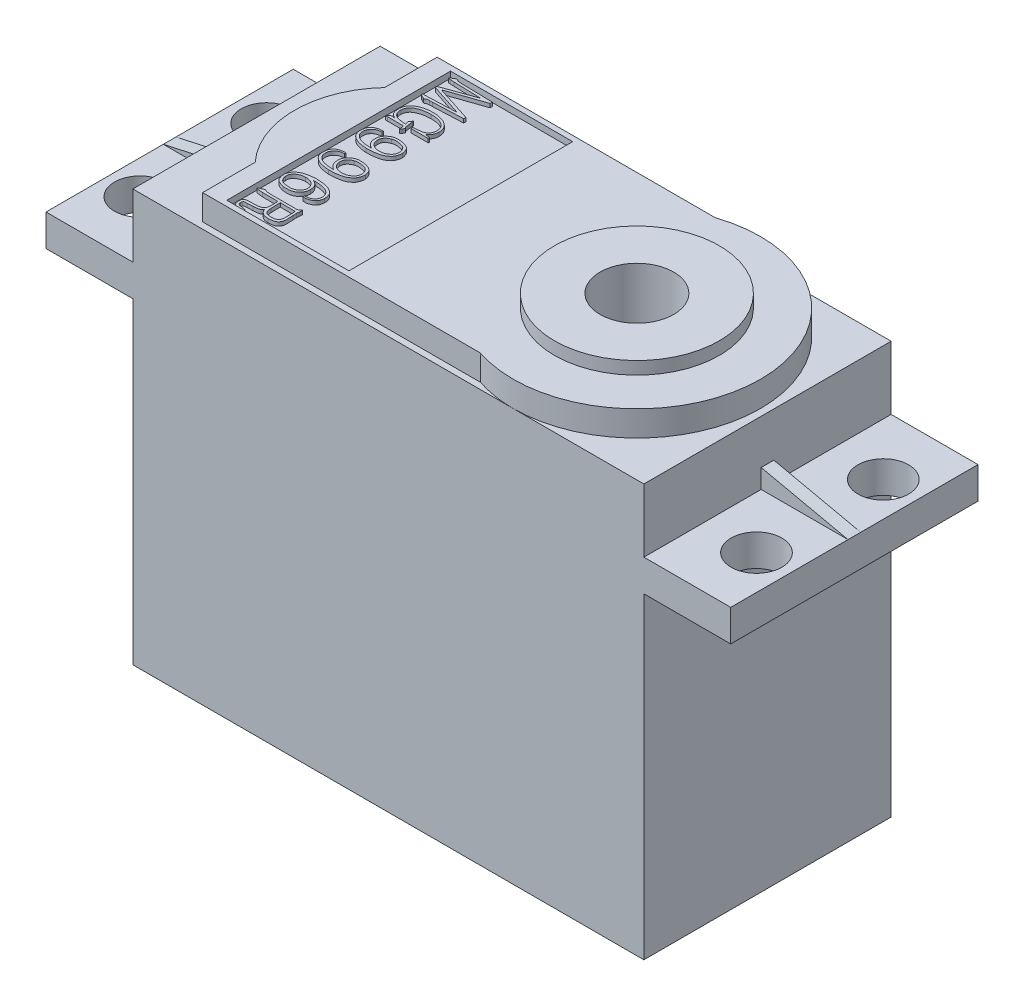
from build123d import *

# Parameters (mm, degrees)
SKETCH_1_W          = 40.3
SKETCH_1_H          = 19.5
EXTRUDE_1_DEPTH     = 27
SKETCH_2_W          = 54
SKETCH_2_H          = 19.5
EXTRUDE_2_DEPTH     = 2.5
SKETCH_3_W          = 40.3
SKETCH_3_H          = 19.5
EXTRUDE_3_DEPTH     = 5
EXTRUDE_4_DEPTH     = 2
RIB_1_REACH         = 48.436
SKETCH_5_WALL_W     = 101.884534654
SKETCH_5_WALL_H     = 1
RIB_2_REACH         = 48.436
SKETCH_6_WALL_W     = 101.884534654
SKETCH_6_WALL_H     = 1
SKETCH_7_R          = 6.5
EXTRUDE_5_DEPTH     = 1
SKETCH_8_R          = 2.9
CUT_EXTRUDE_1_DEPTH = 5
SKETCH_9_R          = 2
CUT_EXTRUDE_2_DEPTH = 5
CHAMFER_1_SIZE      = 2
SKETCH_10_W         = 9.636787174
SKETCH_10_H         = 17.646584306
CUT_EXTRUDE_3_DEPTH = 0.5
EXTRUDE_6_DEPTH     = 0.3


with BuildPart() as part:
    # 草图1 → 凸台-拉伸1 (new body)
    with BuildSketch(Plane(origin=(0, 0, 0), x_dir=(1, 0, 0), z_dir=(0, 1, 0))):
        Rectangle(SKETCH_1_W, SKETCH_1_H)
    extrude(amount=EXTRUDE_1_DEPTH)

    # 草图2 → 凸台-拉伸2 (add)
    with BuildSketch(Plane(origin=(0, 27, 0), x_dir=(1, 0, 0), z_dir=(0, 1, 0))):
        Rectangle(SKETCH_2_W, SKETCH_2_H)
    extrude(amount=EXTRUDE_2_DEPTH)

    # 草图3 → 凸台-拉伸3 (add)
    with BuildSketch(Plane(origin=(0, 29.5, 0), x_dir=(1, 0, 0), z_dir=(0, 1, 0))):
        Rectangle(SKETCH_3_W, SKETCH_3_H)
    extrude(amount=EXTRUDE_3_DEPTH)

    # 草图4 → 凸台-拉伸4 (add)
    with BuildSketch(Plane(origin=(0, 34.5, 0), x_dir=(1, 0, 0), z_dir=(0, 1, 0))):
        with BuildLine():
            Line((-15.15, -9.25), (-15.15, -5.099019514))
            ThreePointArc((-15.15, -5.099019514), (-17.15, 0), (-15.15, 5.099019514))
            Line((-15.15, 5.099019514), (-15.15, 9.25))
            Line((-15.15, 9.25), (6.767792999, 9.25))
            ThreePointArc((6.767792999, 9.25), (19.6, 0), (6.767792999, -9.25))
            Line((6.767792999, -9.25), (-15.15, -9.25))
        make_face()
    extrude(amount=EXTRUDE_4_DEPTH)

    # 草图5 wall → 筋1 (add, up to next)
    with BuildSketch(Plane(origin=(23.575, 30.25, 0), x_dir=(0.976853477736, -0.213909520672, 0), z_dir=(0.213909520672, 0.976853477736, 0)), mode=Mode.PRIVATE) as rib_1_sk1:
        Rectangle(SKETCH_5_WALL_W, SKETCH_5_WALL_H)
    rib_1_tool1 = extrude(rib_1_sk1.sketch, amount=-RIB_1_REACH, mode=Mode.PRIVATE) - part.part
    add(rib_1_tool1.solids().sort_by_distance((23.575, 30.25, 0))[0])

    # 草图6 wall → 筋2 (add, up to next)
    with BuildSketch(Plane(origin=(-23.575, 30.25, 0), x_dir=(-0.976853477736, -0.213909520672, 0), z_dir=(0.213909520672, -0.976853477736, 0)), mode=Mode.PRIVATE) as rib_2_sk1:
        Rectangle(SKETCH_6_WALL_W, SKETCH_6_WALL_H)
    rib_2_tool1 = extrude(rib_2_sk1.sketch, amount=RIB_2_REACH, mode=Mode.PRIVATE) - part.part
    add(rib_2_tool1.solids().sort_by_distance((-23.575, 30.25, 0))[0])

    # 草图7 → 凸台-拉伸5 (add)
    with BuildSketch(Plane(origin=(0, 36.5, 0), x_dir=(1, 0, 0), z_dir=(0, 1, 0))):
        with Locations(Location((9.85, 0, 0), (0, 0, 270))):
            Circle(SKETCH_7_R)
    extrude(amount=EXTRUDE_5_DEPTH)

    # 草图8 → 切除-拉伸1 (cut)
    with BuildSketch(Plane(origin=(0, 37.5, 0), x_dir=(1, 0, 0), z_dir=(0, 1, 0))):
        with Locations(Location((9.85, 0, 0), (0, 0, 270))):
            Circle(SKETCH_8_R)
    extrude(amount=-CUT_EXTRUDE_1_DEPTH, mode=Mode.SUBTRACT)

    # 草图9 → 切除-拉伸2 (cut)
    with BuildSketch(Plane(origin=(0, 29.5, 0), x_dir=(1, 0, 0), z_dir=(0, 1, 0))):
        with Locations(Location((-24.35, 5, 0), (0, 0, 270))):
            Circle(SKETCH_9_R)
        with Locations(Location((24.28, 5, 0), (0, 0, 270))):
            Circle(SKETCH_9_R)
        with Locations(Location((24.28, -5, 0), (0, 0, 270))):
            Circle(SKETCH_9_R)
        with Locations(Location((-24.35, -5, 0), (0, 0, 270))):
            Circle(SKETCH_9_R)
    extrude(amount=-CUT_EXTRUDE_2_DEPTH, mode=Mode.SUBTRACT)

    # 倒角1
    chamfer_1_edges = [part.edges().sort_by_distance(p)[0] for p in [
        (0, 0, 9.75),
        (-20.15, 0, 0),
        (0, 0, -9.75),
        (20.15, 0, 0),
    ]]
    chamfer(chamfer_1_edges, length=CHAMFER_1_SIZE)

    # 草图10 → 切除-拉伸3 (cut)
    with BuildSketch(Plane(origin=(0, 36.5, 0), x_dir=(1, 0, 0), z_dir=(0, 1, 0))):
        with Locations((-8.854580423, 0)):
            Rectangle(SKETCH_10_W, SKETCH_10_H)
    extrude(amount=-CUT_EXTRUDE_3_DEPTH, mode=Mode.SUBTRACT)

    # 草图11 → 凸台-拉伸6 (add)
    # profile 1 of 6: a face of its own
    with BuildSketch(Plane(origin=(0, 36, 0), x_dir=(1, 0, 0), z_dir=(0, 1, 0))):
        with BuildLine():
            Line((-10.108835932, 6.465099099), (-10.108835932, 6.292075447))
            Line((-10.108835932, 6.292075447), (-12.470012152, 6.186918831))
            Line((-12.470012152, 6.186918831), (-12.691512258, 6.179460915))
            add(Edge.make_bspline(
                [(-12.691512258, 6.179460915), (-12.704682236, 6.179133247), (-12.729283425, 6.178521171), (-12.76346004, 6.178820017), (-12.791956525, 6.175085343), (-12.82366459, 6.171706911), (-12.861096032, 6.161497876), (-12.905501006, 6.14652074), (-12.948600061, 6.12856097), (-12.983579582, 6.105935535), (-13.009940886, 6.088203492), (-13.030941587, 6.076001018), (-13.052071154, 6.081143252), (-13.07675673, 6.092617885), (-13.114417302, 6.110357592), (-13.1428217, 6.125832205), (-13.159123594, 6.134713418)],
                knots=[0, 0, 0, 0, 1.102701008, 2.059818031, 2.854660456, 3.504867835, 4.725821617, 6.087517188, 7.428720521, 8.623884165, 9.541296161, 10.147772796, 10.527373255, 11.292252643, 12.445965619, 14, 14, 14, 14], degree=3))
            Line((-13.159123594, 6.134713418), (-13.330655663, 6.217496286))
            add(Edge.make_bspline(
                [(-13.330655663, 6.217496286), (-13.346301752, 6.226705906), (-13.373957393, 6.242984603), (-13.410242295, 6.264089838), (-13.434260872, 6.280820261), (-13.451111532, 6.295883627), (-13.457639739, 6.312784037), (-13.460491623, 6.329808581), (-13.454018711, 6.344742876), (-13.445383369, 6.349890937), (-13.441032821, 6.352484567)],
                knots=[0, 0, 0, 0, 2.092832486, 3.699239191, 4.828075347, 5.47623227, 6.258606608, 6.862868476, 7.427104806, 8, 8, 8, 8], degree=3))
            add(Edge.make_bspline(
                [(-13.441032821, 6.352484567), (-13.435046209, 6.357006622), (-13.420471597, 6.368015719), (-13.386613915, 6.370427585), (-13.342683956, 6.368829873), (-13.309272674, 6.363152374), (-13.290382917, 6.359942483)],
                knots=[0, 0, 0, 0, 0.570562757, 1.389054623, 2.523848169, 4, 4, 4, 4], degree=3))
            Line((-13.290382917, 6.359942483), (-12.973421485, 6.374858315))
            Line((-12.973421485, 6.374858315), (-10.793472625, 6.465099099))
            Line((-10.793472625, 6.465099099), (-13.350792036, 7.306352029))
            Line((-13.350792036, 7.306352029), (-13.345571495, 7.448798226))
            Line((-13.345571495, 7.448798226), (-10.823304289, 8.357918191))
            Line((-10.823304289, 8.357918191), (-12.998032608, 8.41758152))
            Line((-12.998032608, 8.41758152), (-13.31051929, 8.432497352))
            add(Edge.make_bspline(
                [(-13.31051929, 8.432497352), (-13.333162395, 8.433096925), (-13.373834867, 8.434173904), (-13.421285793, 8.442738496), (-13.449423132, 8.454520513), (-13.463828559, 8.462840882), (-13.47192037, 8.474097008), (-13.471707613, 8.481885371), (-13.471610276, 8.485448556)],
                knots=[0, 0, 0, 0, 2.238805083, 4.021433183, 4.714937999, 5.246364549, 5.655210975, 6, 6, 6, 6], degree=3))
            add(Edge.make_bspline(
                [(-13.471610276, 8.485448556), (-13.471003507, 8.490422698), (-13.469760989, 8.500608544), (-13.464368444, 8.518920478), (-13.441676521, 8.536983875), (-13.414414844, 8.549644392), (-13.389590289, 8.562388056), (-13.373328787, 8.568741699), (-13.363189557, 8.57381118), (-13.357766391, 8.57523038), (-13.356012578, 8.57568934)],
                knots=[0, 0, 0, 0, 0.773964204, 1.584892381, 2.85704835, 5.031717749, 6.264108979, 7.138477416, 7.721389708, 8, 8, 8, 8], degree=3))
            Line((-13.356012578, 8.57568934), (-13.12929193, 8.71067762))
            add(Edge.make_bspline(
                [(-13.12929193, 8.71067762), (-13.118000132, 8.714835489), (-13.096054756, 8.722916221), (-13.059642734, 8.719188617), (-13.021934201, 8.706021239), (-12.983971195, 8.684010086), (-12.947744176, 8.664578412), (-12.922530612, 8.648111569), (-12.902132595, 8.640318917), (-12.88212722, 8.635425917), (-12.855703991, 8.631003339), (-12.824755874, 8.627925206), (-12.793918658, 8.624541087), (-12.76736622, 8.621186615), (-12.747347371, 8.619676373), (-12.733594573, 8.616659085), (-12.721571031, 8.615919225), (-12.707482285, 8.613910168), (-12.687009353, 8.613953079), (-12.660454325, 8.611939052), (-12.62762641, 8.610625844), (-12.588826672, 8.609354422), (-12.543871504, 8.606605495), (-12.511781227, 8.605898838), (-12.494623275, 8.605521004)],
                knots=[0, 0, 0, 0, 1.194424872, 2.321340004, 3.585598028, 5.195084956, 6.716837907, 7.724099835, 8.206680761, 8.903637039, 9.790942755, 10.897450691, 12.028789452, 12.90903052, 13.587833776, 14.043805438, 14.319796903, 14.797174648, 15.472288729, 16.373211185, 17.473778476, 18.774068007, 20.27516646, 22, 22, 22, 22], degree=3))
            Line((-12.494623275, 8.605521004), (-10.108835932, 8.5525698))
            Line((-10.108835932, 8.5525698), (-10.108835932, 8.372834024))
            Line((-10.108835932, 8.372834024), (-12.957759861, 7.389134897))
            Line((-12.957759861, 7.389134897), (-10.108835932, 6.465099099))
        make_face()
    # profile 2 of 6: a face of its own
    with BuildSketch(Plane(origin=(0, 36, 0), x_dir=(1, 0, 0), z_dir=(0, 1, 0))):
        with BuildLine():
            add(Edge.make_bspline(
                [(-12.016570856, 3.633097388), (-12.021647518, 3.652280636), (-12.03076964, 3.68675051), (-12.044719979, 3.731948407), (-12.053858919, 3.765503045), (-12.059780228, 3.783512837), (-12.062064144, 3.790459417)],
                knots=[0, 0, 0, 0, 1.45335447, 2.611494566, 3.464437835, 4, 4, 4, 4], degree=3))
            Line((-12.062064144, 3.790459417), (-12.091895808, 3.880700201))
            Line((-12.091895808, 3.880700201), (-11.961382277, 4.091013434))
            add(Edge.make_bspline(
                [(-11.961382277, 4.091013434), (-11.95764498, 4.098911304), (-11.951203836, 4.112523098), (-11.9402981, 4.127653424), (-11.932880434, 4.139131161), (-11.921639555, 4.141195757), (-11.912024596, 4.136085521), (-11.902286107, 4.128530848), (-11.895018331, 4.115280171), (-11.892214574, 4.104775229), (-11.890532075, 4.09847135)],
                knots=[0, 0, 0, 0, 1.721478549, 2.96692782, 3.770230587, 4.273468087, 5.07068514, 5.841502061, 6.704713207, 8, 8, 8, 8], degree=3))
            Line((-11.890532075, 4.09847135), (-11.890532075, 3.918735573))
            Line((-11.890532075, 3.918735573), (-11.865920952, 3.760627753))
            Line((-11.865920952, 3.760627753), (-11.840564037, 3.565230352))
            add(Edge.make_bspline(
                [(-11.840564037, 3.565230352), (-11.840162028, 3.559252954), (-11.839235864, 3.545481981), (-11.835041955, 3.522132366), (-11.829179632, 3.492957832), (-11.820824383, 3.460321199), (-11.810937942, 3.428741104), (-11.801494117, 3.402090312), (-11.791997148, 3.382421014), (-11.783550362, 3.373442244), (-11.780154917, 3.369832952)],
                knots=[0, 0, 0, 0, 0.693923818, 1.598689782, 2.745819235, 4.143502487, 5.501415895, 6.57721006, 7.428066009, 8, 8, 8, 8], degree=3))
            Line((-11.780154917, 3.369832952), (-11.729441088, 3.325085456))
            Line((-11.729441088, 3.325085456), (-11.865920952, 3.099856391))
            add(Edge.make_bspline(
                [(-11.865920952, 3.099856391), (-11.87243382, 3.091409429), (-11.884179754, 3.076175366), (-11.909245223, 3.068627838), (-11.930942215, 3.070906442), (-11.938114446, 3.080675364), (-11.941245904, 3.084940559)],
                knots=[0, 0, 0, 0, 1.365288393, 2.462292284, 3.328623616, 4, 4, 4, 4], degree=3))
            Line((-11.941245904, 3.084940559), (-11.946466445, 3.137145971))
            Line((-11.946466445, 3.137145971), (-11.976298109, 3.422784156))
            Line((-11.976298109, 3.422784156), (-13.229973797, 3.422784156))
            add(Edge.make_bspline(
                [(-13.229973797, 3.422784156), (-13.244392973, 3.422738407), (-13.271493518, 3.422652422), (-13.309039452, 3.423205097), (-13.340625763, 3.42499793), (-13.365941229, 3.426048294), (-13.385578137, 3.428418335), (-13.398365183, 3.430384001), (-13.407429015, 3.432443232), (-13.411696813, 3.445012453), (-13.385309586, 3.460625178), (-13.36488436, 3.486651192), (-13.336295309, 3.511054655), (-13.317530409, 3.523347721), (-13.31051929, 3.527940772)],
                knots=[0, 0, 0, 0, 1.639098295, 3.080651418, 4.268929633, 5.231441294, 5.971084531, 6.486786894, 6.765118723, 6.917305179, 7.861808722, 9.440596986, 11.043731724, 12, 12, 12, 12], degree=3))
            Line((-13.31051929, 3.527940772), (-13.244889629, 3.565230352))
            Line((-13.244889629, 3.565230352), (-13.159123594, 3.633097388))
            add(Edge.make_bspline(
                [(-13.159123594, 3.633097388), (-13.146154335, 3.644078661), (-13.123962245, 3.662869046), (-13.095589921, 3.668179848), (-13.083798642, 3.670386969)],
                knots=[0, 0, 0, 0, 1.168818219, 2, 2, 2, 2], degree=3))
            Line((-13.083798642, 3.670386969), (-13.033830605, 3.64801322))
            Line((-13.033830605, 3.64801322), (-12.852603245, 3.603265724))
            add(Edge.make_bspline(
                [(-12.852603245, 3.603265724), (-12.867399777, 3.612186044), (-12.903250392, 3.633799144), (-12.968893526, 3.664498462), (-13.047123989, 3.711006729), (-13.117809344, 3.760299608), (-13.174934311, 3.811766987), (-13.213339127, 3.862889077), (-13.248589014, 3.922388097), (-13.279385523, 3.990143332), (-13.303949319, 4.064058483), (-13.323898904, 4.140922715), (-13.335616519, 4.220456159), (-13.338762673, 4.274196694), (-13.340350954, 4.301326666)],
                knots=[0, 0, 0, 0, 0.682902113, 1.654608042, 2.861894888, 4.27790553, 5.056999099, 5.890804738, 6.7945336, 7.788805481, 8.827203978, 9.871588867, 10.925508771, 12, 12, 12, 12], degree=3))
            add(Edge.make_bspline(
                [(-13.340350954, 4.301326666), (-13.341940522, 4.350836096), (-13.345091513, 4.448978324), (-13.326442491, 4.592912429), (-13.292190675, 4.726681274), (-13.25368063, 4.830601442), (-13.213612534, 4.906343899), (-13.177069526, 4.960352736), (-13.135370597, 5.013586381), (-13.086579538, 5.065131773), (-13.030565256, 5.115198821), (-12.968467346, 5.165453956), (-12.897407972, 5.212437881), (-12.821414587, 5.26072982), (-12.73809616, 5.304610792), (-12.649992499, 5.346457258), (-12.555596708, 5.381607507), (-12.457731362, 5.413206976), (-12.358925393, 5.440526842), (-12.262587694, 5.46268715), (-12.170095629, 5.480355716), (-12.0495276, 5.496170554), (-11.893992789, 5.507582247), (-11.698364174, 5.512172169), (-11.490086988, 5.505114558), (-11.348942954, 5.483844991), (-11.276745584, 5.472965277)],
                knots=[0, 0, 0, 0, 1.296855289, 2.57074797, 3.787781431, 4.912090985, 5.466017155, 6.029935049, 6.619226251, 7.236981103, 7.887517514, 8.587730122, 9.328811339, 10.1190631, 10.947078726, 11.7954872, 12.674165492, 13.585070334, 14.490996303, 15.360442995, 16.175900064, 16.95837495, 18.546785394, 20.261144089, 22.087517035, 24, 24, 24, 24], degree=3))
            add(Edge.make_bspline(
                [(-11.276745584, 5.472965277), (-11.216348356, 5.460773639), (-11.091172659, 5.435505976), (-10.936361232, 5.387401561), (-10.81054485, 5.339150776), (-10.716945988, 5.294161799), (-10.626009385, 5.2411581), (-10.539301178, 5.181241338), (-10.458164336, 5.117914641), (-10.38874973, 5.049025594), (-10.330268829, 4.977785742), (-10.28462195, 4.904086956), (-10.249144363, 4.832119898), (-10.219122017, 4.765825903), (-10.198344634, 4.704467913), (-10.178965571, 4.62962431), (-10.166206376, 4.535641468), (-10.161318651, 4.460208543), (-10.158803969, 4.421399114)],
                knots=[0, 0, 0, 0, 1.756852838, 3.641148545, 4.615675158, 5.598961219, 6.599988407, 7.614985252, 8.604008524, 9.53171328, 10.398925515, 11.227312903, 11.997988587, 12.687082964, 13.301564504, 13.84336769, 14.890435854, 16, 16, 16, 16], degree=3))
            add(Edge.make_bspline(
                [(-10.158803969, 4.421399114), (-10.159141256, 4.39701416), (-10.159800316, 4.349365888), (-10.167630771, 4.279849194), (-10.179363786, 4.213999276), (-10.201223391, 4.131357165), (-10.2408323, 4.032759587), (-10.296319275, 3.943804905), (-10.343832513, 3.880375629), (-10.374724041, 3.840206157), (-10.400800081, 3.808079983), (-10.418222387, 3.790601084), (-10.425797364, 3.783001501)],
                knots=[0, 0, 0, 0, 1.02865205, 2.009989184, 2.948380583, 3.849248544, 5.614353784, 7.40828352, 8.256022902, 8.959034023, 9.547402437, 10, 10, 10, 10], degree=3))
            Line((-10.425797364, 3.783001501), (-10.506342857, 3.723338172))
            Line((-10.506342857, 3.723338172), (-10.149108678, 3.633097388))
            Line((-10.149108678, 3.633097388), (-10.149108678, 3.542856604))
            Line((-10.149108678, 3.542856604), (-11.513161523, 3.542856604))
            Line((-11.513161523, 3.542856604), (-11.518382064, 3.700964424))
            add(Edge.make_bspline(
                [(-11.518382064, 3.700964424), (-11.494516912, 3.700993837), (-11.443306274, 3.701056952), (-11.362996534, 3.700518785), (-11.277679241, 3.702741595), (-11.204310309, 3.706944425), (-11.142412917, 3.71285101), (-11.089765308, 3.719851413), (-11.030540559, 3.727917603), (-10.945737283, 3.741418456), (-10.843168344, 3.761391359), (-10.728025613, 3.794020556), (-10.624300382, 3.846026221), (-10.545049291, 3.90394052), (-10.486576367, 3.9598194), (-10.448308991, 4.006569324), (-10.415692478, 4.056163292), (-10.389682737, 4.109701182), (-10.368430427, 4.166860401), (-10.353527533, 4.228313927), (-10.340794228, 4.293429615), (-10.337334012, 4.33855561), (-10.335556579, 4.361735786)],
                knots=[0, 0, 0, 0, 0.935739115, 2.007940184, 3.148747064, 4.28148865, 4.888643423, 5.586238389, 6.363702558, 7.232250513, 8.952694186, 10.46050143, 11.907734915, 13.477168468, 14.290584882, 15.073104099, 15.840915301, 16.612491364, 17.401961071, 18.22703269, 19.08926784, 20, 20, 20, 20], degree=3))
            add(Edge.make_bspline(
                [(-10.335556579, 4.361735786), (-10.335580197, 4.397066303), (-10.335625925, 4.465472279), (-10.347582513, 4.565124053), (-10.37015442, 4.65780567), (-10.401475804, 4.745057683), (-10.444097366, 4.826727585), (-10.500686167, 4.901700191), (-10.567916464, 4.972556241), (-10.647656039, 5.035118281), (-10.733041407, 5.091670803), (-10.8214353, 5.141257933), (-10.911764576, 5.182876201), (-11.00429001, 5.213827957), (-11.09535869, 5.240115387), (-11.184887601, 5.25998781), (-11.271589532, 5.276293122), (-11.384409812, 5.288266877), (-11.523188684, 5.297704281), (-11.633961755, 5.29919746), (-11.689168342, 5.299941624)],
                knots=[0, 0, 0, 0, 1.020336309, 1.975547117, 2.892045996, 3.771563378, 4.648848181, 5.542539332, 6.477435802, 7.463615751, 8.463825308, 9.435109215, 10.389941754, 11.332781131, 12.251473469, 13.128081502, 13.982025083, 14.799156052, 16.404777764, 18, 18, 18, 18], degree=3))
            add(Edge.make_bspline(
                [(-11.689168342, 5.299941624), (-11.724974246, 5.299471703), (-11.798136937, 5.298511507), (-11.909638669, 5.291772929), (-12.025001156, 5.279418405), (-12.14221632, 5.263456395), (-12.258135948, 5.243300153), (-12.368366602, 5.217110383), (-12.471587762, 5.186846331), (-12.566628434, 5.151572511), (-12.653503114, 5.11472244), (-12.730847334, 5.076515869), (-12.799523511, 5.039492682), (-12.859015828, 5.00117928), (-12.911027122, 4.961688993), (-12.958378925, 4.921762301), (-12.998043298, 4.877093274), (-13.045568035, 4.817749644), (-13.091724475, 4.738586852), (-13.134206575, 4.639833837), (-13.161405891, 4.533647798), (-13.166770118, 4.459846685), (-13.169564677, 4.421399114)],
                knots=[0, 0, 0, 0, 1.126994854, 2.302803905, 3.514286971, 4.778011192, 6.025865863, 7.215856767, 8.342308229, 9.409248108, 10.404825957, 11.311169663, 12.123616097, 12.859383373, 13.535435401, 14.178772448, 14.804598141, 15.411954719, 16.570030134, 17.674526722, 18.788516934, 20, 20, 20, 20], degree=3))
            add(Edge.make_bspline(
                [(-13.169564677, 4.421399114), (-13.16985608, 4.386316288), (-13.170441224, 4.315869475), (-13.157030293, 4.210912261), (-13.129869876, 4.109408321), (-13.087395742, 4.013953017), (-13.027141284, 3.928054887), (-12.952783995, 3.851832096), (-12.864987057, 3.789441367), (-12.767751494, 3.743352468), (-12.666254484, 3.71188741), (-12.564462631, 3.687752023), (-12.465114221, 3.673085447), (-12.368574285, 3.658374033), (-12.2702776, 3.647930969), (-12.203034871, 3.6430834), (-12.167966552, 3.640555304)],
                knots=[0, 0, 0, 0, 1.012518681, 2.033151841, 3.045161207, 4.038142276, 5.034026654, 6.059673631, 7.099696739, 8.127377512, 9.153727986, 10.16390169, 11.146023905, 12.052814435, 12.984506943, 14, 14, 14, 14], degree=3))
            Line((-12.167966552, 3.640555304), (-12.016570856, 3.633097388))
        make_face()
    # profile 3 of 6: a face of its own
    with BuildSketch(Plane(origin=(0, 36, 0), x_dir=(1, 0, 0), z_dir=(0, 1, 0))):
        with BuildLine():
            Line((-12.414077781, 2.268813555), (-12.414077781, 2.163656939))
            add(Edge.make_bspline(
                [(-12.414077781, 2.163656939), (-12.44542573, 2.160668995), (-12.507048225, 2.15479542), (-12.599993343, 2.141611829), (-12.696043038, 2.119254882), (-12.779345352, 2.091657499), (-12.849455582, 2.061763536), (-12.90176306, 2.029299544), (-12.954267596, 1.991653222), (-13.004197507, 1.946110866), (-13.051863982, 1.895943641), (-13.09468963, 1.840664874), (-13.131044182, 1.780210269), (-13.163353959, 1.716833701), (-13.188384197, 1.649106561), (-13.204328061, 1.577873112), (-13.213950786, 1.503412625), (-13.212825702, 1.427435802), (-13.207542935, 1.353594204), (-13.195936167, 1.28540785), (-13.181675372, 1.223692734), (-13.161066901, 1.167376939), (-13.132366663, 1.113616899), (-13.092264796, 1.060977341), (-13.043956236, 1.004929239), (-12.985498039, 0.947722114), (-12.916594011, 0.893202795), (-12.838495744, 0.842610722), (-12.750613574, 0.79907992), (-12.654824026, 0.760562789), (-12.551714342, 0.727991537), (-12.443203192, 0.701101815), (-12.32995949, 0.676969593), (-12.252330612, 0.666814914), (-12.212714048, 0.661632647)],
                knots=[0, 0, 0, 0, 1.161562506, 2.283351267, 3.460054047, 4.793976417, 5.516494263, 6.265077708, 7.059282141, 7.896977086, 8.753286989, 9.609842358, 10.470120195, 11.351831039, 12.23086742, 13.125078708, 14.039560616, 14.993248057, 15.92232611, 16.76806327, 17.542052076, 18.255787675, 18.973752159, 19.780770556, 20.690874171, 21.702495583, 22.792346145, 23.926806676, 25.12840101, 26.40383237, 27.73206904, 29.113223073, 30.526782984, 32, 32, 32, 32], degree=3))
            Line((-12.212714048, 0.661632647), (-11.915888989, 0.646716815))
            Line((-11.915888989, 0.646716815), (-11.719745797, 0.639258899))
            add(Edge.make_bspline(
                [(-11.719745797, 0.639258899), (-11.739747007, 0.649746172), (-11.777613157, 0.669600603), (-11.829647537, 0.700882217), (-11.875894713, 0.727884953), (-11.929015728, 0.761979623), (-11.988661304, 0.812380244), (-12.043950603, 0.870692419), (-12.085779294, 0.926515077), (-12.117480445, 0.975061982), (-12.14630396, 1.030681831), (-12.177392739, 1.090661998), (-12.202692749, 1.158498399), (-12.220518193, 1.234120407), (-12.230705647, 1.317153045), (-12.232116873, 1.375077846), (-12.232850421, 1.405186877)],
                knots=[0, 0, 0, 0, 0.96811683, 1.832831972, 2.602442467, 3.264690643, 4.536676004, 5.939331142, 6.700405402, 7.525311046, 8.421957077, 9.384896146, 10.420381823, 11.516576881, 12.70912866, 14, 14, 14, 14], degree=3))
            add(Edge.make_bspline(
                [(-12.232850421, 1.405186877), (-12.232715044, 1.449026481), (-12.232449848, 1.534905208), (-12.212699941, 1.640486274), (-12.186644903, 1.719994074), (-12.162684317, 1.778346849), (-12.132631424, 1.834798489), (-12.097562987, 1.890410817), (-12.055776597, 1.94448805), (-12.008560622, 1.997956038), (-11.953797877, 2.049877041), (-11.893834962, 2.10023768), (-11.830173425, 2.147798751), (-11.762997505, 2.188242095), (-11.694714092, 2.222513156), (-11.62396715, 2.250845196), (-11.549306263, 2.272538726), (-11.469224025, 2.288256456), (-11.382844054, 2.296882908), (-11.260569601, 2.300125219), (-11.106204748, 2.294580826), (-10.98404056, 2.277305763), (-10.923986155, 2.268813555)],
                knots=[0, 0, 0, 0, 1.441778134, 2.824342836, 3.513038675, 4.195722577, 4.898866133, 5.616586851, 6.358372924, 7.147065104, 7.963527037, 8.8409299, 9.725181631, 10.577472986, 11.419597639, 12.23905066, 13.08363918, 13.976378112, 14.923014095, 15.938750632, 18.003540029, 20, 20, 20, 20], degree=3))
            add(Edge.make_bspline(
                [(-10.923986155, 2.268813555), (-10.89431214, 2.263797098), (-10.832400256, 2.253330757), (-10.736909571, 2.227575847), (-10.636121448, 2.190028632), (-10.548601466, 2.153968912), (-10.479055449, 2.119308712), (-10.430340779, 2.089427208), (-10.386378535, 2.056477276), (-10.346184972, 2.021323467), (-10.310999484, 1.98261503), (-10.281502191, 1.94023537), (-10.254374513, 1.896272028), (-10.228587781, 1.833771264), (-10.202149444, 1.758760775), (-10.175310411, 1.675493616), (-10.157268708, 1.601213243), (-10.151693191, 1.554411864), (-10.149108678, 1.532717242)],
                knots=[0, 0, 0, 0, 1.232643308, 2.571787759, 4.044217922, 5.637139245, 6.447978167, 7.225371298, 7.975044785, 8.696580882, 9.410528117, 10.111496744, 10.810241716, 11.521787165, 12.874996824, 14.070206042, 15.105450454, 16, 16, 16, 16], degree=3))
            add(Edge.make_bspline(
                [(-10.149108678, 1.532717242), (-10.148474471, 1.497131692), (-10.147174111, 1.424168163), (-10.159725114, 1.331624044), (-10.176970542, 1.253800505), (-10.197746889, 1.190486256), (-10.223945955, 1.122101322), (-10.256518063, 1.050671028), (-10.296219652, 0.979619787), (-10.342981608, 0.912505364), (-10.398816039, 0.852768739), (-10.481218537, 0.782401301), (-10.590159926, 0.706551752), (-10.702718624, 0.636388884), (-10.802451085, 0.591070664), (-10.890407058, 0.560855999), (-10.991901327, 0.533690314), (-11.102061735, 0.510277211), (-11.210922839, 0.49216258), (-11.307638352, 0.474093707), (-11.388361881, 0.46199144), (-11.475294925, 0.448049735), (-11.579819865, 0.438001365), (-11.705515358, 0.432235999), (-11.827623089, 0.429412303), (-11.90569547, 0.429091668), (-11.941245904, 0.428945667)],
                knots=[0, 0, 0, 0, 1.074749016, 2.203632703, 2.812577277, 3.482852542, 4.21560841, 5.02606841, 5.853870657, 6.673375128, 7.49239699, 8.318183911, 9.94494759, 11.501953483, 12.319249415, 13.250994979, 14.31026013, 15.493928427, 16.654173563, 17.646367651, 18.468040354, 19.121719855, 20.307771699, 21.639741468, 22.925250984, 24, 24, 24, 24], degree=3))
            add(Edge.make_bspline(
                [(-11.941245904, 0.428945667), (-12.000685926, 0.434376772), (-12.114260558, 0.44475422), (-12.277414462, 0.464219139), (-12.427770637, 0.490523193), (-12.570046067, 0.519513745), (-12.706224597, 0.562023525), (-12.817501853, 0.604801875), (-12.905087559, 0.649661861), (-12.971897296, 0.690068724), (-13.040066252, 0.736383915), (-13.107031353, 0.788402602), (-13.170946404, 0.842944433), (-13.223552267, 0.902912875), (-13.268981409, 0.961934293), (-13.301039695, 1.024074528), (-13.326762685, 1.084540206), (-13.345285203, 1.143609361), (-13.362131971, 1.199424493), (-13.374075378, 1.270792387), (-13.382555685, 1.356503448), (-13.381257206, 1.424310441), (-13.380623701, 1.457392289)],
                knots=[0, 0, 0, 0, 1.797086707, 3.433771622, 4.944792553, 6.392286608, 7.801005391, 9.235339341, 9.97510545, 10.760669027, 11.584826592, 12.454621118, 13.313625219, 14.108616606, 14.852611278, 15.549122826, 16.2066196, 16.829103701, 17.412039301, 17.959645049, 19.004546411, 20, 20, 20, 20], degree=3))
            add(Edge.make_bspline(
                [(-13.380623701, 1.457392289), (-13.379313013, 1.487006255), (-13.376738072, 1.545185052), (-13.365561483, 1.630803976), (-13.347341854, 1.712666905), (-13.324631, 1.791253172), (-13.295406691, 1.865275995), (-13.257361751, 1.932515738), (-13.214599542, 1.994596289), (-13.162874758, 2.048584025), (-13.104967765, 2.096337999), (-13.041280993, 2.139323172), (-12.970830276, 2.175706373), (-12.894047871, 2.20626343), (-12.810812333, 2.231774385), (-12.720267489, 2.25107432), (-12.622461033, 2.263564744), (-12.554818462, 2.267029226), (-12.519980189, 2.268813555)],
                knots=[0, 0, 0, 0, 1.06190317, 2.086186327, 3.089135659, 4.064405996, 5.01557864, 5.932729571, 6.827456307, 7.709678761, 8.601607318, 9.513290962, 10.457597657, 11.436887401, 12.471039678, 13.57352987, 14.750283629, 16, 16, 16, 16], degree=3))
            Line((-12.519980189, 2.268813555), (-12.414077781, 2.268813555))
        make_face()
        with BuildLine():
            add(Edge.make_bspline(
                [(-11.196200091, 0.744415516), (-11.150823587, 0.746424174), (-11.059260051, 0.750477369), (-10.945739471, 0.774447421), (-10.854977302, 0.80242442), (-10.786602189, 0.831424657), (-10.71742748, 0.864739449), (-10.649485937, 0.905058896), (-10.58278847, 0.9502622), (-10.522824061, 1.004268871), (-10.468188136, 1.064088263), (-10.419617849, 1.129973522), (-10.379439108, 1.203260131), (-10.351538886, 1.284354291), (-10.336806537, 1.372564312), (-10.335981547, 1.433474315), (-10.335556579, 1.464850206)],
                knots=[0, 0, 0, 0, 1.5235734, 3.074361288, 3.879823378, 4.710974347, 5.566147304, 6.45690185, 7.362598751, 8.267525502, 9.160039468, 10.080284655, 11.010589524, 11.955949148, 12.947070884, 14, 14, 14, 14], degree=3))
            add(Edge.make_bspline(
                [(-10.335556579, 1.464850206), (-10.337202096, 1.493303378), (-10.340469652, 1.549803798), (-10.360299511, 1.632611919), (-10.38885597, 1.712962616), (-10.429552392, 1.787784808), (-10.475125428, 1.856310019), (-10.526344562, 1.914737625), (-10.581303574, 1.961692556), (-10.641842281, 1.996052967), (-10.706519032, 2.021340218), (-10.775167609, 2.045143659), (-10.850155793, 2.063358723), (-10.95534793, 2.082308783), (-11.08566123, 2.099280248), (-11.213831773, 2.111305566), (-11.31489447, 2.111778411), (-11.393042917, 2.10020069), (-11.475404469, 2.081237357), (-11.530249563, 2.061345008), (-11.558654811, 2.051042407)],
                knots=[0, 0, 0, 0, 0.972972678, 1.932064543, 2.900345298, 3.881603781, 4.836654803, 5.710067057, 6.530870687, 7.29649367, 8.078048887, 8.903463193, 9.779849899, 10.713699583, 12.55822633, 14.272574297, 15.114335027, 16.006539535, 16.967551431, 18, 18, 18, 18], degree=3))
            add(Edge.make_bspline(
                [(-11.558654811, 2.051042407), (-11.582756421, 2.042916042), (-11.631330738, 2.026538188), (-11.700429798, 1.991185259), (-11.768202538, 1.950512029), (-11.831134617, 1.901813345), (-11.887832833, 1.848695459), (-11.937294598, 1.793837109), (-11.975371307, 1.735631963), (-12.005321294, 1.676222568), (-12.025171898, 1.613896163), (-12.03884212, 1.549477259), (-12.044988698, 1.481844146), (-12.042961517, 1.436015023), (-12.041927771, 1.412644793)],
                knots=[0, 0, 0, 0, 1.054537953, 2.125312858, 3.213844798, 4.332630889, 5.420575597, 6.437056958, 7.390216681, 8.299455536, 9.190412501, 10.097188084, 11.029674824, 12, 12, 12, 12], degree=3))
            add(Edge.make_bspline(
                [(-12.041927771, 1.412644793), (-12.040389102, 1.384722069), (-12.037384091, 1.330189149), (-12.021263967, 1.251611784), (-11.997600604, 1.178600848), (-11.965421964, 1.112171304), (-11.926962421, 1.053195476), (-11.887376204, 0.999833047), (-11.844175117, 0.954744132), (-11.798644518, 0.915306476), (-11.746954765, 0.882488637), (-11.690503807, 0.851180422), (-11.627229987, 0.821918907), (-11.557096535, 0.795219976), (-11.479271682, 0.771047187), (-11.392222627, 0.756868924), (-11.297184423, 0.745379757), (-11.230797707, 0.744745868), (-11.196200091, 0.744415516)],
                knots=[0, 0, 0, 0, 1.11008112, 2.167982033, 3.177103922, 4.15363553, 5.090948019, 5.972227589, 6.789849659, 7.567832268, 8.359741834, 9.217618185, 10.132587918, 11.127046302, 12.199198304, 13.363859354, 14.626168178, 16, 16, 16, 16], degree=3))
        make_face(mode=Mode.SUBTRACT)
    # profile 4 of 6: a face of its own
    with BuildSketch(Plane(origin=(0, 36, 0), x_dir=(1, 0, 0), z_dir=(0, 1, 0))):
        with BuildLine():
            Line((-12.414077781, -0.687735354), (-12.414077781, -0.79289197))
            add(Edge.make_bspline(
                [(-12.414077781, -0.79289197), (-12.44542573, -0.795879914), (-12.507048225, -0.801753489), (-12.599993343, -0.81493708), (-12.696043038, -0.837294027), (-12.779345352, -0.864891409), (-12.849455582, -0.894785373), (-12.90176306, -0.927249365), (-12.954267596, -0.964895687), (-13.004197507, -1.010438043), (-13.051863982, -1.060605268), (-13.09468963, -1.115884035), (-13.131044182, -1.17633864), (-13.163353959, -1.239715208), (-13.188384197, -1.307442348), (-13.204328061, -1.378675797), (-13.213950786, -1.453136284), (-13.212825702, -1.529113107), (-13.207542935, -1.602954705), (-13.195936167, -1.671141058), (-13.181675372, -1.732856174), (-13.161066901, -1.78917197), (-13.132366663, -1.84293201), (-13.092264796, -1.895571568), (-13.043956236, -1.95161967), (-12.985498039, -2.008826794), (-12.916594011, -2.063346114), (-12.838495744, -2.113938187), (-12.750613574, -2.157468989), (-12.654824026, -2.19598612), (-12.551714342, -2.228557372), (-12.443203192, -2.255447094), (-12.32995949, -2.279579315), (-12.252330612, -2.289733995), (-12.212714048, -2.294916261)],
                knots=[0, 0, 0, 0, 1.161562506, 2.283351267, 3.460054047, 4.793976417, 5.516494263, 6.265077708, 7.059282141, 7.896977086, 8.753286989, 9.609842358, 10.470120195, 11.351831039, 12.23086742, 13.125078708, 14.039560616, 14.993248057, 15.92232611, 16.76806327, 17.542052076, 18.255787675, 18.973752159, 19.780770556, 20.690874171, 21.702495583, 22.792346145, 23.926806676, 25.12840101, 26.40383237, 27.73206904, 29.113223073, 30.526782984, 32, 32, 32, 32], degree=3))
            Line((-12.212714048, -2.294916261), (-11.915888989, -2.309832093))
            Line((-11.915888989, -2.309832093), (-11.719745797, -2.317290009))
            add(Edge.make_bspline(
                [(-11.719745797, -2.317290009), (-11.739747007, -2.306802737), (-11.777613157, -2.286948306), (-11.829647537, -2.255666692), (-11.875894713, -2.228663956), (-11.929015728, -2.194569286), (-11.988661304, -2.144168665), (-12.043950603, -2.08585649), (-12.085779294, -2.030033832), (-12.117480445, -1.981486926), (-12.14630396, -1.925867077), (-12.177392739, -1.865886911), (-12.202692749, -1.79805051), (-12.220518193, -1.722428502), (-12.230705647, -1.639395864), (-12.232116873, -1.581471063), (-12.232850421, -1.551362032)],
                knots=[0, 0, 0, 0, 0.96811683, 1.832831972, 2.602442467, 3.264690643, 4.536676004, 5.939331142, 6.700405402, 7.525311046, 8.421957077, 9.384896146, 10.420381823, 11.516576881, 12.70912866, 14, 14, 14, 14], degree=3))
            add(Edge.make_bspline(
                [(-12.232850421, -1.551362032), (-12.232715044, -1.507522428), (-12.232449848, -1.421643701), (-12.212699941, -1.316062635), (-12.186644903, -1.236554834), (-12.162684317, -1.17820206), (-12.132631424, -1.12175042), (-12.097562987, -1.066138092), (-12.055776597, -1.012060858), (-12.008560622, -0.958592871), (-11.953797877, -0.906671868), (-11.893834962, -0.856311229), (-11.830173425, -0.808750158), (-11.762997505, -0.768306814), (-11.694714092, -0.734035753), (-11.62396715, -0.705703713), (-11.549306263, -0.684010183), (-11.469224025, -0.668292453), (-11.382844054, -0.659666001), (-11.260569601, -0.656423689), (-11.106204748, -0.661968083), (-10.98404056, -0.679243146), (-10.923986155, -0.687735354)],
                knots=[0, 0, 0, 0, 1.441778134, 2.824342836, 3.513038675, 4.195722577, 4.898866133, 5.616586851, 6.358372924, 7.147065104, 7.963527037, 8.8409299, 9.725181631, 10.577472986, 11.419597639, 12.23905066, 13.08363918, 13.976378112, 14.923014095, 15.938750632, 18.003540029, 20, 20, 20, 20], degree=3))
            add(Edge.make_bspline(
                [(-10.923986155, -0.687735354), (-10.89431214, -0.692751811), (-10.832400256, -0.703218152), (-10.736909571, -0.728973061), (-10.636121448, -0.766520277), (-10.548601466, -0.802579997), (-10.479055449, -0.837240197), (-10.430340779, -0.867121701), (-10.386378535, -0.900071633), (-10.346184972, -0.935225442), (-10.310999484, -0.973933879), (-10.281502191, -1.016313539), (-10.254374513, -1.060276881), (-10.228587781, -1.122777645), (-10.202149444, -1.197788133), (-10.175310411, -1.281055293), (-10.157268708, -1.355335666), (-10.151693191, -1.402137045), (-10.149108678, -1.423831667)],
                knots=[0, 0, 0, 0, 1.232643308, 2.571787759, 4.044217922, 5.637139245, 6.447978167, 7.225371298, 7.975044785, 8.696580882, 9.410528117, 10.111496744, 10.810241716, 11.521787165, 12.874996824, 14.070206042, 15.105450454, 16, 16, 16, 16], degree=3))
            add(Edge.make_bspline(
                [(-10.149108678, -1.423831667), (-10.148474471, -1.459417217), (-10.147174111, -1.532380745), (-10.159725114, -1.624924865), (-10.176970542, -1.702748404), (-10.197746889, -1.766062653), (-10.223945955, -1.834447587), (-10.256518063, -1.905877881), (-10.296219652, -1.976929122), (-10.342981608, -2.044043545), (-10.398816039, -2.10378017), (-10.481218537, -2.174147608), (-10.590159926, -2.249997157), (-10.702718624, -2.320160024), (-10.802451085, -2.365478245), (-10.890407058, -2.39569291), (-10.991901327, -2.422858595), (-11.102061735, -2.446271698), (-11.210922839, -2.464386329), (-11.307638352, -2.482455202), (-11.388361881, -2.494557468), (-11.475294925, -2.508499174), (-11.579819865, -2.518547544), (-11.705515358, -2.524312909), (-11.827623089, -2.527136606), (-11.90569547, -2.52745724), (-11.941245904, -2.527603242)],
                knots=[0, 0, 0, 0, 1.074749016, 2.203632703, 2.812577277, 3.482852542, 4.21560841, 5.02606841, 5.853870657, 6.673375128, 7.49239699, 8.318183911, 9.94494759, 11.501953483, 12.319249415, 13.250994979, 14.31026013, 15.493928427, 16.654173563, 17.646367651, 18.468040354, 19.121719855, 20.307771699, 21.639741468, 22.925250984, 24, 24, 24, 24], degree=3))
            add(Edge.make_bspline(
                [(-11.941245904, -2.527603242), (-12.000685926, -2.522172137), (-12.114260558, -2.511794689), (-12.277414462, -2.49232977), (-12.427770637, -2.466025716), (-12.570046067, -2.437035164), (-12.706224597, -2.394525384), (-12.817501853, -2.351747033), (-12.905087559, -2.306887048), (-12.971897296, -2.266480184), (-13.040066252, -2.220164994), (-13.107031353, -2.168146307), (-13.170946404, -2.113604476), (-13.223552267, -2.053636034), (-13.268981409, -1.994614616), (-13.301039695, -1.932474381), (-13.326762685, -1.872008703), (-13.345285203, -1.812939548), (-13.362131971, -1.757124416), (-13.374075378, -1.685756521), (-13.382555685, -1.600045461), (-13.381257206, -1.532238468), (-13.380623701, -1.499156619)],
                knots=[0, 0, 0, 0, 1.797086707, 3.433771622, 4.944792553, 6.392286608, 7.801005391, 9.235339341, 9.97510545, 10.760669027, 11.584826592, 12.454621118, 13.313625219, 14.108616606, 14.852611278, 15.549122826, 16.2066196, 16.829103701, 17.412039301, 17.959645049, 19.004546411, 20, 20, 20, 20], degree=3))
            add(Edge.make_bspline(
                [(-13.380623701, -1.499156619), (-13.379313013, -1.469542654), (-13.376738072, -1.411363857), (-13.365561483, -1.325744933), (-13.347341854, -1.243882003), (-13.324631, -1.165295736), (-13.295406691, -1.091272914), (-13.257361751, -1.024033171), (-13.214599542, -0.96195262), (-13.162874758, -0.907964883), (-13.104967765, -0.86021091), (-13.041280993, -0.817225736), (-12.970830276, -0.780842536), (-12.894047871, -0.750285478), (-12.810812333, -0.724774524), (-12.720267489, -0.705474589), (-12.622461033, -0.692984165), (-12.554818462, -0.689519682), (-12.519980189, -0.687735354)],
                knots=[0, 0, 0, 0, 1.06190317, 2.086186327, 3.089135659, 4.064405996, 5.01557864, 5.932729571, 6.827456307, 7.709678761, 8.601607318, 9.513290962, 10.457597657, 11.436887401, 12.471039678, 13.57352987, 14.750283629, 16, 16, 16, 16], degree=3))
            Line((-12.519980189, -0.687735354), (-12.414077781, -0.687735354))
        make_face()
        with BuildLine():
            add(Edge.make_bspline(
                [(-11.196200091, -2.212133393), (-11.150823587, -2.210124735), (-11.059260051, -2.20607154), (-10.945739471, -2.182101488), (-10.854977302, -2.154124489), (-10.786602189, -2.125124252), (-10.71742748, -2.091809459), (-10.649485937, -2.051490013), (-10.58278847, -2.006286709), (-10.522824061, -1.952280038), (-10.468188136, -1.892460645), (-10.419617849, -1.826575386), (-10.379439108, -1.753288777), (-10.351538886, -1.672194618), (-10.336806537, -1.583984597), (-10.335981547, -1.523074594), (-10.335556579, -1.491698703)],
                knots=[0, 0, 0, 0, 1.5235734, 3.074361288, 3.879823378, 4.710974347, 5.566147304, 6.45690185, 7.362598751, 8.267525502, 9.160039468, 10.080284655, 11.010589524, 11.955949148, 12.947070884, 14, 14, 14, 14], degree=3))
            add(Edge.make_bspline(
                [(-10.335556579, -1.491698703), (-10.337202096, -1.463245531), (-10.340469652, -1.40674511), (-10.360299511, -1.32393699), (-10.38885597, -1.243586293), (-10.429552392, -1.168764101), (-10.475125428, -1.10023889), (-10.526344562, -1.041811284), (-10.581303574, -0.994856353), (-10.641842281, -0.960495942), (-10.706519032, -0.935208691), (-10.775167609, -0.91140525), (-10.850155793, -0.893190186), (-10.95534793, -0.874240126), (-11.08566123, -0.857268661), (-11.213831773, -0.845243343), (-11.31489447, -0.844770498), (-11.393042917, -0.856348219), (-11.475404469, -0.875311551), (-11.530249563, -0.895203901), (-11.558654811, -0.905506502)],
                knots=[0, 0, 0, 0, 0.972972678, 1.932064543, 2.900345298, 3.881603781, 4.836654803, 5.710067057, 6.530870687, 7.29649367, 8.078048887, 8.903463193, 9.779849899, 10.713699583, 12.55822633, 14.272574297, 15.114335027, 16.006539535, 16.967551431, 18, 18, 18, 18], degree=3))
            add(Edge.make_bspline(
                [(-11.558654811, -0.905506502), (-11.582756421, -0.913632867), (-11.631330738, -0.93001072), (-11.700429798, -0.96536365), (-11.768202538, -1.00603688), (-11.831134617, -1.054735563), (-11.887832833, -1.107853449), (-11.937294598, -1.1627118), (-11.975371307, -1.220916945), (-12.005321294, -1.280326341), (-12.025171898, -1.342652745), (-12.03884212, -1.40707165), (-12.044988698, -1.474704763), (-12.042961517, -1.520533886), (-12.041927771, -1.543904116)],
                knots=[0, 0, 0, 0, 1.054537953, 2.125312858, 3.213844798, 4.332630889, 5.420575597, 6.437056958, 7.390216681, 8.299455536, 9.190412501, 10.097188084, 11.029674824, 12, 12, 12, 12], degree=3))
            add(Edge.make_bspline(
                [(-12.041927771, -1.543904116), (-12.040389102, -1.57182684), (-12.037384091, -1.62635976), (-12.021263967, -1.704937125), (-11.997600604, -1.777948061), (-11.965421964, -1.844377605), (-11.926962421, -1.903353433), (-11.887376204, -1.956715862), (-11.844175117, -2.001804776), (-11.798644518, -2.041242433), (-11.746954765, -2.074060271), (-11.690503807, -2.105368487), (-11.627229987, -2.134630002), (-11.557096535, -2.161328933), (-11.479271682, -2.185501722), (-11.392222627, -2.199679985), (-11.297184423, -2.211169152), (-11.230797707, -2.21180304), (-11.196200091, -2.212133393)],
                knots=[0, 0, 0, 0, 1.11008112, 2.167982033, 3.177103922, 4.15363553, 5.090948019, 5.972227589, 6.789849659, 7.567832268, 8.359741834, 9.217618185, 10.132587918, 11.127046302, 12.199198304, 13.363859354, 14.626168178, 16, 16, 16, 16], degree=3))
        make_face(mode=Mode.SUBTRACT)
    # profile 5 of 6: a face of its own
    with BuildSketch(Plane(origin=(0, 36, 0), x_dir=(1, 0, 0), z_dir=(0, 1, 0))):
        with BuildLine():
            Line((-11.095518224, -5.378995535), (-11.095518224, -5.273838918))
            add(Edge.make_bspline(
                [(-11.095518224, -5.273838918), (-11.065523042, -5.266916168), (-11.006321471, -5.253252716), (-10.915046783, -5.240672416), (-10.820429178, -5.223703167), (-10.738243264, -5.201958306), (-10.670076499, -5.17590382), (-10.618060961, -5.150158488), (-10.567709408, -5.117060025), (-10.51793017, -5.079962759), (-10.471883144, -5.035919144), (-10.430668092, -4.98691123), (-10.395985793, -4.932068029), (-10.367045542, -4.872847398), (-10.34471981, -4.808998847), (-10.328728584, -4.741833597), (-10.321548869, -4.671164554), (-10.32200084, -4.599027915), (-10.327497392, -4.52865648), (-10.338817178, -4.463071546), (-10.354203069, -4.40405179), (-10.374698339, -4.349613951), (-10.403554862, -4.298080036), (-10.441605825, -4.246276943), (-10.489623632, -4.192678673), (-10.547386204, -4.138217897), (-10.613676241, -4.084256823), (-10.690344501, -4.036810468), (-10.775175374, -3.995067828), (-10.867412218, -3.959015158), (-10.964891541, -3.928153229), (-11.066210337, -3.902517204), (-11.170414037, -3.883391146), (-11.275085129, -3.870058086), (-11.374816105, -3.859608707), (-11.465143539, -3.853324665), (-11.543433397, -3.848172538), (-11.591711637, -3.847464266), (-11.61384339, -3.847139579)],
                knots=[0, 0, 0, 0, 1.182055615, 2.33302632, 3.537557068, 4.874499188, 5.591082481, 6.338570267, 7.098944115, 7.903162823, 8.720600909, 9.541157723, 10.357199672, 11.207242995, 12.06816288, 12.950847206, 13.853711824, 14.789714585, 15.719311818, 16.562513094, 17.343249245, 18.059832538, 18.790846611, 19.604705802, 20.52478464, 21.551688937, 22.652506848, 23.802605396, 25.007136144, 26.28058143, 27.603599906, 28.933255437, 30.29326573, 31.671068629, 32.986376677, 34.145245984, 35.149742073, 36, 36, 36, 36], degree=3))
            Line((-11.61384339, -3.847139579), (-11.809986582, -3.839681663))
            add(Edge.make_bspline(
                [(-11.809986582, -3.839681663), (-11.791598464, -3.849636794), (-11.756479494, -3.86864983), (-11.706125659, -3.89566648), (-11.662122602, -3.923145078), (-11.608879971, -3.956412776), (-11.547506579, -4.004309388), (-11.492134278, -4.061133148), (-11.450047992, -4.113861295), (-11.419146811, -4.159495873), (-11.391317068, -4.211675095), (-11.362917646, -4.268927192), (-11.338967532, -4.334519804), (-11.320403347, -4.408954419), (-11.308050804, -4.492900204), (-11.304151253, -4.552121881), (-11.302102499, -4.583235892)],
                knots=[0, 0, 0, 0, 0.918560096, 1.754333114, 2.509062541, 3.196661576, 4.51162187, 5.917009976, 6.670790853, 7.473375694, 8.333546217, 9.266404328, 10.278650327, 11.393644308, 12.630667267, 14, 14, 14, 14], degree=3))
            add(Edge.make_bspline(
                [(-11.302102499, -4.583235892), (-11.302653215, -4.606360865), (-11.303720512, -4.651177503), (-11.308471376, -4.716293335), (-11.318418165, -4.777058652), (-11.336291902, -4.853898601), (-11.372376843, -4.949245252), (-11.425152479, -5.040438853), (-11.478657549, -5.112737549), (-11.526502798, -5.166212576), (-11.580741131, -5.218208408), (-11.640948818, -5.26718307), (-11.705694819, -5.312632139), (-11.773100029, -5.352851968), (-11.843222915, -5.38677651), (-11.916051075, -5.414560716), (-11.992652708, -5.436329472), (-12.074037561, -5.451764762), (-12.160487324, -5.462370979), (-12.281521175, -5.467306314), (-12.432641544, -5.465403788), (-12.552357814, -5.452956388), (-12.610966765, -5.446862571)],
                knots=[0, 0, 0, 0, 0.76782226, 1.488054225, 2.165008663, 2.809499616, 4.104647548, 5.531432271, 6.292261022, 7.087185547, 7.910099264, 8.78390083, 9.660697474, 10.533875398, 11.386416856, 12.24310153, 13.118149049, 14.02604129, 14.990203372, 16.006389156, 18.044866092, 20, 20, 20, 20], degree=3))
            add(Edge.make_bspline(
                [(-12.610966765, -5.446862571), (-12.641387945, -5.439756968), (-12.7047438, -5.424958675), (-12.802070117, -5.394607969), (-12.904997196, -5.35614925), (-12.994102657, -5.320517992), (-13.064713665, -5.28717772), (-13.113521212, -5.257439371), (-13.158422274, -5.226149775), (-13.197467938, -5.19013097), (-13.232834292, -5.152492284), (-13.262983818, -5.110822968), (-13.288187082, -5.066153852), (-13.314965, -5.004753656), (-13.339833393, -4.93052172), (-13.363050812, -4.848062897), (-13.380115565, -4.776279139), (-13.384055767, -4.731219178), (-13.385844242, -4.710766257)],
                knots=[0, 0, 0, 0, 1.280462768, 2.666721463, 4.175753658, 5.784537071, 6.600468298, 7.373044328, 8.125388954, 8.839773088, 9.546629102, 10.239758449, 10.942635465, 11.645290764, 12.982927028, 14.147714346, 15.159239144, 16, 16, 16, 16], degree=3))
            add(Edge.make_bspline(
                [(-13.385844242, -4.710766257), (-13.387942029, -4.673468435), (-13.392108615, -4.599388213), (-13.38088656, -4.506017634), (-13.362900315, -4.429922727), (-13.342441573, -4.367785963), (-13.316264955, -4.300109559), (-13.28317571, -4.22923686), (-13.244722757, -4.157893998), (-13.19679217, -4.092502963), (-13.143195371, -4.033004672), (-13.062173275, -3.964501839), (-12.95459557, -3.891482069), (-12.841806252, -3.826090598), (-12.742407154, -3.781600118), (-12.653467503, -3.751610011), (-12.550199287, -3.724400452), (-12.437721729, -3.700566349), (-12.326566096, -3.679879821), (-12.227367926, -3.660346982), (-12.144418902, -3.647313331), (-12.056644609, -3.633970312), (-11.958878321, -3.624420978), (-11.843566567, -3.621060079), (-11.722163581, -3.622786643), (-11.638194869, -3.627088986), (-11.593707016, -3.62936843)],
                knots=[0, 0, 0, 0, 1.127946963, 2.240306763, 2.827401215, 3.490643746, 4.216528174, 5.020317349, 5.854836915, 6.66227332, 7.465746091, 8.270483732, 9.863603515, 11.391769427, 12.206139136, 13.152263146, 14.226243847, 15.433765677, 16.627900378, 17.645166694, 18.490450359, 19.166560297, 20.329652657, 21.457825026, 22.653118473, 24, 24, 24, 24], degree=3))
            add(Edge.make_bspline(
                [(-11.593707016, -3.62936843), (-11.558149612, -3.63069695), (-11.491226418, -3.63319738), (-11.397229762, -3.639150836), (-11.316100368, -3.646209122), (-11.222938555, -3.658656856), (-11.108770113, -3.679337088), (-10.969106538, -3.711384436), (-10.828511043, -3.749759092), (-10.716388551, -3.792306121), (-10.630110464, -3.832032632), (-10.564498596, -3.870628029), (-10.496555794, -3.917074946), (-10.427802627, -3.970810812), (-10.360188086, -4.029108098), (-10.301975046, -4.095713429), (-10.251582186, -4.16591142), (-10.209431478, -4.241576213), (-10.177780819, -4.325715389), (-10.155488057, -4.419596163), (-10.143939682, -4.524521113), (-10.143905821, -4.597877558), (-10.143888137, -4.636187096)],
                knots=[0, 0, 0, 0, 1.072883581, 2.019292388, 2.839797231, 3.527846551, 4.852704371, 6.336569881, 7.848123795, 9.243121205, 9.94731464, 10.709744439, 11.535165391, 12.427325713, 13.340557098, 14.222040827, 15.087343855, 15.942850684, 16.825481101, 17.789100088, 18.845383591, 20, 20, 20, 20], degree=3))
            add(Edge.make_bspline(
                [(-10.143888137, -4.636187096), (-10.146016601, -4.674815491), (-10.15000886, -4.747268937), (-10.168287975, -4.847622434), (-10.192156718, -4.933086247), (-10.226756101, -5.002360075), (-10.265440436, -5.058024524), (-10.300686949, -5.106752529), (-10.3349375, -5.147538737), (-10.369784587, -5.18127862), (-10.408385337, -5.209675617), (-10.451729389, -5.237559904), (-10.502936161, -5.264035942), (-10.558714314, -5.289842848), (-10.615299742, -5.312569814), (-10.667290014, -5.333078699), (-10.71334372, -5.348728277), (-10.76858246, -5.364659879), (-10.841631281, -5.377330525), (-10.901795382, -5.378410031), (-10.934427238, -5.378995535)],
                knots=[0, 0, 0, 0, 1.716839845, 3.220194992, 4.523355905, 5.644458898, 6.639892113, 7.532218586, 8.315595483, 9.002949146, 9.681013819, 10.440760297, 11.290451841, 12.239151237, 13.170203699, 13.998748635, 14.721644693, 15.329931267, 16.55180585, 18, 18, 18, 18], degree=3))
            Line((-10.934427238, -5.378995535), (-11.095518224, -5.378995535))
        make_face()
        with BuildLine():
            add(Edge.make_bspline(
                [(-12.338752829, -3.937380363), (-12.383631126, -3.93943972), (-12.476206002, -3.943687757), (-12.616147352, -3.973266654), (-12.758777497, -4.021268363), (-12.873670806, -4.080742468), (-12.962458052, -4.137718325), (-13.021943703, -4.190064564), (-13.076524538, -4.247619554), (-13.123420137, -4.312604778), (-13.162489023, -4.384188843), (-13.187651247, -4.464389197), (-13.201540217, -4.551674207), (-13.200127634, -4.612273041), (-13.199396341, -4.643645012)],
                knots=[0, 0, 0, 0, 1.295309146, 2.671961586, 4.113274932, 5.628383699, 6.394794715, 7.153062794, 7.909698579, 8.680666818, 9.460900758, 10.253060361, 11.095610644, 12, 12, 12, 12], degree=3))
            add(Edge.make_bspline(
                [(-13.199396341, -4.643645012), (-13.197669718, -4.670839365), (-13.194244076, -4.724793334), (-13.175693231, -4.803838412), (-13.146949145, -4.879940118), (-13.108742755, -4.952255952), (-13.062002103, -5.017405075), (-13.01152903, -5.075409973), (-12.954606226, -5.121914233), (-12.893633515, -5.159778786), (-12.828148757, -5.188341385), (-12.759736218, -5.211557784), (-12.687966674, -5.229767293), (-12.586958234, -5.244612923), (-12.457755599, -5.256190177), (-12.32700521, -5.266785851), (-12.220495152, -5.267803579), (-12.13842139, -5.259827947), (-12.054764489, -5.245203303), (-11.999301187, -5.229582478), (-11.971077568, -5.221633506)],
                knots=[0, 0, 0, 0, 0.937823481, 1.860654707, 2.785234323, 3.735769758, 4.670024897, 5.543783043, 6.377515342, 7.193087954, 8.009964655, 8.833642814, 9.681475724, 10.557625032, 12.348808739, 14.152062403, 15.077395984, 16.015219465, 16.990004426, 18, 18, 18, 18], degree=3))
            add(Edge.make_bspline(
                [(-11.971077568, -5.221633506), (-11.947778741, -5.212084062), (-11.90100557, -5.192913234), (-11.833572583, -5.156721781), (-11.76853077, -5.113958326), (-11.706602795, -5.065601845), (-11.650836601, -5.012328318), (-11.601317797, -4.957766056), (-11.563413506, -4.899326957), (-11.532630996, -4.840055931), (-11.51201471, -4.778614531), (-11.495116434, -4.717080778), (-11.488203549, -4.654001743), (-11.487937813, -4.61183212), (-11.487804608, -4.590693809)],
                knots=[0, 0, 0, 0, 1.066212734, 2.140457608, 3.23586737, 4.360948912, 5.463524558, 6.50084126, 7.473538388, 8.406124289, 9.322149833, 10.213629035, 11.104548165, 12, 12, 12, 12], degree=3))
            add(Edge.make_bspline(
                [(-11.487804608, -4.590693809), (-11.490422314, -4.564988345), (-11.495608567, -4.514060143), (-11.514137804, -4.439820363), (-11.53982373, -4.36836778), (-11.575369732, -4.302225637), (-11.614223533, -4.241463769), (-11.654580845, -4.186896243), (-11.696644857, -4.140676719), (-11.741704682, -4.101960614), (-11.791095691, -4.06801556), (-11.847755041, -4.03790041), (-11.91270451, -4.01024318), (-11.985194749, -3.985268993), (-12.064735046, -3.963405686), (-12.150799055, -3.947854441), (-12.242854683, -3.939011843), (-12.306167105, -3.937934732), (-12.338752829, -3.937380363)],
                knots=[0, 0, 0, 0, 1.037189887, 2.054902349, 3.066367949, 4.080740418, 5.064593554, 5.963742612, 6.805145821, 7.570189383, 8.346114571, 9.208837332, 10.144167935, 11.180491371, 12.288045921, 13.455957307, 14.690628626, 16, 16, 16, 16], degree=3))
        make_face(mode=Mode.SUBTRACT)
    # profile 6 of 6: a face of its own
    with BuildSketch(Plane(origin=(0, 36, 0), x_dir=(1, 0, 0), z_dir=(0, 1, 0))):
        with BuildLine():
            add(Edge.make_bspline(
                [(-11.73466163, -7.750098034), (-11.75628746, -7.77271503), (-11.795282892, -7.813497718), (-11.850182454, -7.870956373), (-11.910393819, -7.915631741), (-11.985256774, -7.944898077), (-12.0748764, -7.96716731), (-12.178631868, -7.984501122), (-12.293517259, -7.995673014), (-12.373281206, -7.997014647), (-12.414077781, -7.997700846)],
                knots=[0, 0, 0, 0, 0.995686697, 1.795409961, 2.526317484, 3.359181013, 4.331732692, 5.462905728, 6.70236167, 8, 8, 8, 8], degree=3))
            Line((-12.414077781, -7.997700846), (-12.882434909, -8.020820386))
            add(Edge.make_bspline(
                [(-12.882434909, -8.020820386), (-12.908527618, -8.021010324), (-12.959050101, -8.021378094), (-13.030244549, -8.026754223), (-13.089662218, -8.036982477), (-13.133465271, -8.053940063), (-13.154329242, -8.084958716), (-13.16303781, -8.121223916), (-13.168521119, -8.17103873), (-13.169188293, -8.208982168), (-13.169564677, -8.230387827)],
                knots=[0, 0, 0, 0, 1.437498069, 2.783381736, 3.91353111, 4.788919647, 5.240830167, 5.9120994, 6.822118141, 8, 8, 8, 8], degree=3))
            add(Edge.make_bspline(
                [(-13.169564677, -8.230387827), (-13.170163157, -8.251541804), (-13.171280915, -8.291050279), (-13.160187245, -8.347282245), (-13.132479955, -8.394480498), (-13.08848937, -8.429828556), (-13.032978689, -8.454330168), (-12.96673555, -8.469235494), (-12.888875219, -8.480042305), (-12.832702297, -8.488831223), (-12.801889416, -8.493652263)],
                knots=[0, 0, 0, 0, 0.974057147, 1.819209313, 2.605279672, 3.443019789, 4.376183234, 5.379457947, 6.562537807, 8, 8, 8, 8], degree=3))
            Line((-12.801889416, -8.493652263), (-12.514759648, -8.530941844))
            Line((-12.514759648, -8.530941844), (-12.514759648, -8.628640544))
            Line((-12.514759648, -8.628640544), (-12.867519077, -8.628640544))
            add(Edge.make_bspline(
                [(-12.867519077, -8.628640544), (-12.900830438, -8.628098342), (-12.962279519, -8.627098149), (-13.046583735, -8.622875017), (-13.114827387, -8.61309257), (-13.169415683, -8.601262635), (-13.213477745, -8.582267664), (-13.250078181, -8.556764772), (-13.28151616, -8.524645127), (-13.306418384, -8.486298898), (-13.326690935, -8.443610136), (-13.340958942, -8.397515605), (-13.352112413, -8.3489541), (-13.357655284, -8.283453538), (-13.359147605, -8.208495905), (-13.356976539, -8.150833512), (-13.356012578, -8.125231211)],
                knots=[0, 0, 0, 0, 1.637394661, 3.020482914, 4.143452809, 5.023450626, 5.756530539, 6.485117998, 7.202143121, 7.950933674, 8.721432797, 9.517275881, 10.317606838, 11.164858243, 12.741187289, 14, 14, 14, 14], degree=3))
            add(Edge.make_bspline(
                [(-13.356012578, -8.125231211), (-13.354964985, -8.107529111), (-13.352957222, -8.07360216), (-13.34318072, -8.026340918), (-13.329751842, -7.984881915), (-13.311941048, -7.948953538), (-13.287698676, -7.91828052), (-13.258594666, -7.891076831), (-13.222661697, -7.86880138), (-13.180449206, -7.849567244), (-13.128694925, -7.834780105), (-13.065993708, -7.823435704), (-12.991040304, -7.814386527), (-12.936906849, -7.811863912), (-12.907791823, -7.810507154)],
                knots=[0, 0, 0, 0, 1.018546357, 1.952094535, 2.765767194, 3.520146589, 4.243552423, 5.002253397, 5.799307091, 6.662928998, 7.662439212, 8.884788459, 10.324521058, 12, 12, 12, 12], degree=3))
            Line((-12.907791823, -7.810507154), (-12.666155344, -7.802303446))
            Line((-12.666155344, -7.802303446), (-12.419298322, -7.79484553))
            add(Edge.make_bspline(
                [(-12.419298322, -7.79484553), (-12.386970227, -7.791704987), (-12.318271302, -7.785031166), (-12.230995951, -7.774961966), (-12.159205051, -7.765276775), (-12.108796497, -7.754405784), (-12.06327091, -7.742936954), (-12.00939707, -7.724247925), (-11.948318421, -7.691517669), (-11.883946407, -7.639606642), (-11.831921262, -7.574792297), (-11.79648483, -7.497033147), (-11.776819741, -7.406671931), (-11.765793813, -7.302182349), (-11.761662346, -7.181815449), (-11.763999361, -7.096531927), (-11.765239085, -7.0512913)],
                knots=[0, 0, 0, 0, 1.153014876, 2.450218061, 3.119198905, 3.723266681, 4.279822422, 4.785029111, 5.744395477, 6.723012573, 7.702981735, 8.666398814, 9.72811919, 10.971707851, 12.393572051, 14, 14, 14, 14], degree=3))
            Line((-11.765239085, -7.0512913), (-11.785375459, -6.683616039))
            Line((-11.785375459, -6.683616039), (-12.973421485, -6.683616039))
            add(Edge.make_bspline(
                [(-12.973421485, -6.683616039), (-13.012444931, -6.680058453), (-13.083521403, -6.673578741), (-13.179293438, -6.665890055), (-13.253564392, -6.658604782), (-13.321580076, -6.653543285), (-13.38661082, -6.645442195), (-13.441376166, -6.635042337), (-13.477169369, -6.625584751), (-13.492280806, -6.617590804), (-13.503742041, -6.609765642), (-13.502117012, -6.603454821), (-13.501441941, -6.600833171)],
                knots=[0, 0, 0, 0, 2.154454918, 3.924078221, 5.282830656, 6.256746636, 7.675761681, 8.873990736, 9.345303106, 9.669333738, 9.862634207, 10, 10, 10, 10], degree=3))
            add(Edge.make_bspline(
                [(-13.501441941, -6.600833171), (-13.500775479, -6.597584782), (-13.499190635, -6.589860122), (-13.493314196, -6.574936418), (-13.47489809, -6.556157148), (-13.445771609, -6.537172941), (-13.414237381, -6.516353356), (-13.390516517, -6.512287893), (-13.380623701, -6.510592387)],
                knots=[0, 0, 0, 0, 0.376532682, 0.895393679, 1.795415736, 3.291464798, 4.870401955, 6, 6, 6, 6], degree=3))
            Line((-13.380623701, -6.510592387), (-13.199396341, -6.421097395))
            add(Edge.make_bspline(
                [(-13.199396341, -6.421097395), (-13.183016874, -6.41238524), (-13.154380843, -6.397153883), (-13.117436215, -6.377809459), (-13.092204476, -6.367614249), (-13.071232147, -6.36235497), (-13.050179479, -6.374559488), (-13.023790176, -6.392781132), (-12.986323699, -6.414301586), (-12.940927518, -6.433050206), (-12.894429278, -6.44720457), (-12.855747663, -6.458192918), (-12.819366608, -6.462904023), (-12.77856334, -6.466348975), (-12.723355809, -6.469982414), (-12.659212645, -6.473424201), (-12.596793923, -6.475978035), (-12.546828494, -6.478267586), (-12.514755441, -6.479681547), (-12.499346393, -6.480507542), (-12.494623275, -6.480760723)],
                knots=[0, 0, 0, 0, 1.357234848, 2.372837909, 3.034150711, 3.365679393, 3.895353147, 4.696586083, 5.762456536, 7.024422522, 8.282721517, 9.313806242, 9.956130017, 10.959471828, 12.306944025, 13.998976521, 15.653829955, 16.872282771, 17.654336697, 18, 18, 18, 18], degree=3))
            Line((-12.494623275, -6.480760723), (-10.52647923, -6.480760723))
            add(Edge.make_bspline(
                [(-10.52647923, -6.480760723), (-10.51121547, -6.480426524), (-10.481780877, -6.479782057), (-10.440423325, -6.468087703), (-10.401866576, -6.453668819), (-10.380948624, -6.436862668), (-10.370608785, -6.428555311)],
                knots=[0, 0, 0, 0, 1.086168667, 2.094564597, 3.058134517, 4, 4, 4, 4], degree=3))
            Line((-10.370608785, -6.428555311), (-10.295283833, -6.353230359))
            add(Edge.make_bspline(
                [(-10.295283833, -6.353230359), (-10.286304961, -6.34546948), (-10.270472465, -6.331784679), (-10.246939731, -6.317490719), (-10.228555262, -6.308778589), (-10.210587558, -6.310438721), (-10.200905609, -6.328161471), (-10.19827014, -6.354950158), (-10.198419412, -6.394936037), (-10.202165203, -6.425866145), (-10.204297257, -6.443471143)],
                knots=[0, 0, 0, 0, 1.231288639, 2.17113822, 2.857961449, 3.329660216, 3.867541673, 4.759985217, 6.15582761, 8, 8, 8, 8], degree=3))
            Line((-10.204297257, -6.443471143), (-10.214738339, -6.600833171))
            Line((-10.214738339, -6.600833171), (-10.229654172, -6.758940991))
            Line((-10.229654172, -6.758940991), (-10.214738339, -7.0512913))
            add(Edge.make_bspline(
                [(-10.214738339, -7.0512913), (-10.213531267, -7.081373127), (-10.211206745, -7.139303255), (-10.207290333, -7.222564438), (-10.204273167, -7.298635994), (-10.202176954, -7.367510733), (-10.200048634, -7.42916791), (-10.197460935, -7.483836253), (-10.196345002, -7.531343393), (-10.193893307, -7.584745678), (-10.193873848, -7.646179225), (-10.202564164, -7.717571992), (-10.217239993, -7.787554696), (-10.238895769, -7.855200471), (-10.266023791, -7.918707609), (-10.298358955, -7.97663891), (-10.33476964, -8.028688275), (-10.377266104, -8.074305528), (-10.426680194, -8.114014017), (-10.485136586, -8.147000062), (-10.552858705, -8.173378877), (-10.62886736, -8.194629361), (-10.712438645, -8.210933294), (-10.802726317, -8.221353126), (-10.899229164, -8.229506328), (-10.965730993, -8.230087728), (-11.000056899, -8.230387827)],
                knots=[0, 0, 0, 0, 1.256756243, 2.420200484, 3.479525115, 4.434768006, 5.296667858, 6.054869107, 6.719357103, 7.280129511, 8.286806225, 9.279261192, 10.276587265, 11.267739227, 12.239302684, 13.154530435, 14.032768728, 14.884487561, 15.748321955, 16.668654065, 17.674581644, 18.775043366, 19.959540696, 21.224837104, 22.5675585, 24, 24, 24, 24], degree=3))
            add(Edge.make_bspline(
                [(-11.000056899, -8.230387827), (-11.03289617, -8.230130052), (-11.094445961, -8.229646911), (-11.179803698, -8.221811656), (-11.252483313, -8.211805805), (-11.329637287, -8.189984262), (-11.412215234, -8.153482856), (-11.500555592, -8.102983975), (-11.576431803, -8.04492835), (-11.629789924, -7.992676088), (-11.663347226, -7.949903969), (-11.683369587, -7.920126173), (-11.696967284, -7.8910695), (-11.702326782, -7.871740353), (-11.704829965, -7.862712566)],
                knots=[0, 0, 0, 0, 1.396980943, 2.618325005, 3.646373059, 4.514035026, 6.021406674, 7.476825324, 8.8354153, 10.077346411, 10.642485442, 11.147251967, 11.601719227, 12, 12, 12, 12], degree=3))
            Line((-11.704829965, -7.862712566), (-11.73466163, -7.750098034))
        make_face()
        with BuildLine():
            Line((-11.598927557, -6.676158123), (-11.578791184, -7.419712353))
            add(Edge.make_bspline(
                [(-11.578791184, -7.419712353), (-11.577628823, -7.449316388), (-11.575426843, -7.505398377), (-11.56727794, -7.584606286), (-11.555768268, -7.654241956), (-11.540050486, -7.714589176), (-11.521182735, -7.76695503), (-11.499829892, -7.812522405), (-11.475506884, -7.851803935), (-11.44942575, -7.886477078), (-11.417773323, -7.915583191), (-11.380700418, -7.939990224), (-11.338460862, -7.961742663), (-11.289459417, -7.981012661), (-11.230378658, -7.995873645), (-11.158928533, -8.006337577), (-11.07406983, -8.014656874), (-10.979216779, -8.017689484), (-10.882724563, -8.017358554), (-10.792734203, -8.008142254), (-10.712703995, -7.993874078), (-10.664764155, -7.976222622), (-10.642076929, -7.967869182)],
                knots=[0, 0, 0, 0, 1.330065929, 2.519681637, 3.57307806, 4.496360706, 5.315594864, 6.069562176, 6.751135885, 7.387515937, 8.011537919, 8.670996601, 9.374964204, 10.141958047, 11.030018285, 12.103626296, 13.382100992, 14.856653183, 16.363802565, 17.710024958, 18.916283822, 20, 20, 20, 20], degree=3))
            add(Edge.make_bspline(
                [(-10.642076929, -7.967869182), (-10.620865587, -7.958813445), (-10.580469977, -7.941567389), (-10.527267282, -7.906587172), (-10.483536972, -7.866411225), (-10.45139711, -7.817879217), (-10.427610342, -7.762611476), (-10.408909786, -7.699310278), (-10.396646068, -7.626443512), (-10.392785879, -7.574632845), (-10.390745158, -7.547242717)],
                knots=[0, 0, 0, 0, 1.0507058, 2.001000297, 2.891799798, 3.741405517, 4.635306219, 5.629617364, 6.746878043, 8, 8, 8, 8], degree=3))
            add(Edge.make_bspline(
                [(-10.390745158, -7.547242717), (-10.390705943, -7.538292829), (-10.390610075, -7.516412935), (-10.391679654, -7.477886731), (-10.392319183, -7.427420097), (-10.392865974, -7.365015072), (-10.394704419, -7.29044599), (-10.395842818, -7.203922645), (-10.398417558, -7.105489978), (-10.399740956, -7.035879227), (-10.400440449, -6.999085888)],
                knots=[0, 0, 0, 0, 0.391770237, 0.95776521, 1.68697436, 2.601169688, 3.689637975, 4.952196355, 6.389058172, 8, 8, 8, 8], degree=3))
            Line((-10.400440449, -6.999085888), (-10.410881531, -6.683616039))
            Line((-10.410881531, -6.683616039), (-11.598927557, -6.676158123))
        make_face(mode=Mode.SUBTRACT)
    extrude(amount=EXTRUDE_6_DEPTH)


solid = part.part
